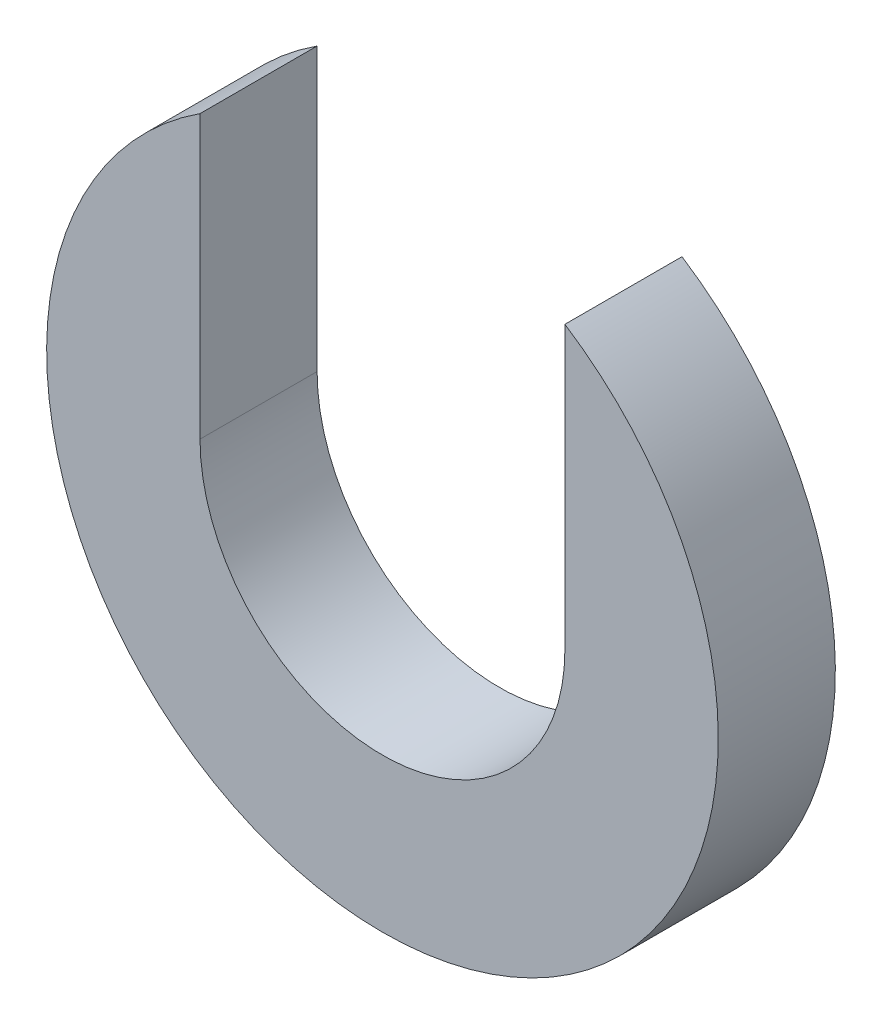
from build123d import *

# Parameters (mm, degrees)
SKETCH1_R               = 9.12
BOSS_EXTRUDE1_DEPTH     = 3.18
CUT_EXTRUDE1_DEPTH      = 14.283869918
CUT_EXTRUDE1_DEPTH_BACK = 14.283869918


with BuildPart() as part:
    # Sketch1 → Boss-Extrude1 (new body)
    with BuildSketch(Plane.XY):
        with Locations(Location((0, 0, 0), (0, 0, 180))):
            Circle(SKETCH1_R)
    extrude(amount=BOSS_EXTRUDE1_DEPTH)

    # Sketch2 → Cut-Extrude1 (cut, two sides: drawn at the far end of the back side and taken through both)
    with BuildSketch(Plane.XY.offset(3.18).offset(-CUT_EXTRUDE1_DEPTH_BACK)):
        with BuildLine():
            Line((-4.955, 0), (-4.955, 7.656524995))
            ThreePointArc((-4.955, 7.656524995), (0, 9.12), (4.955, 7.656524995))
            Line((4.955, 7.656524995), (4.955, 0))
            ThreePointArc((4.955, 0), (0, -4.955), (-4.955, 0))
        make_face()
    extrude(amount=CUT_EXTRUDE1_DEPTH + CUT_EXTRUDE1_DEPTH_BACK, mode=Mode.SUBTRACT)


solid = part.part
